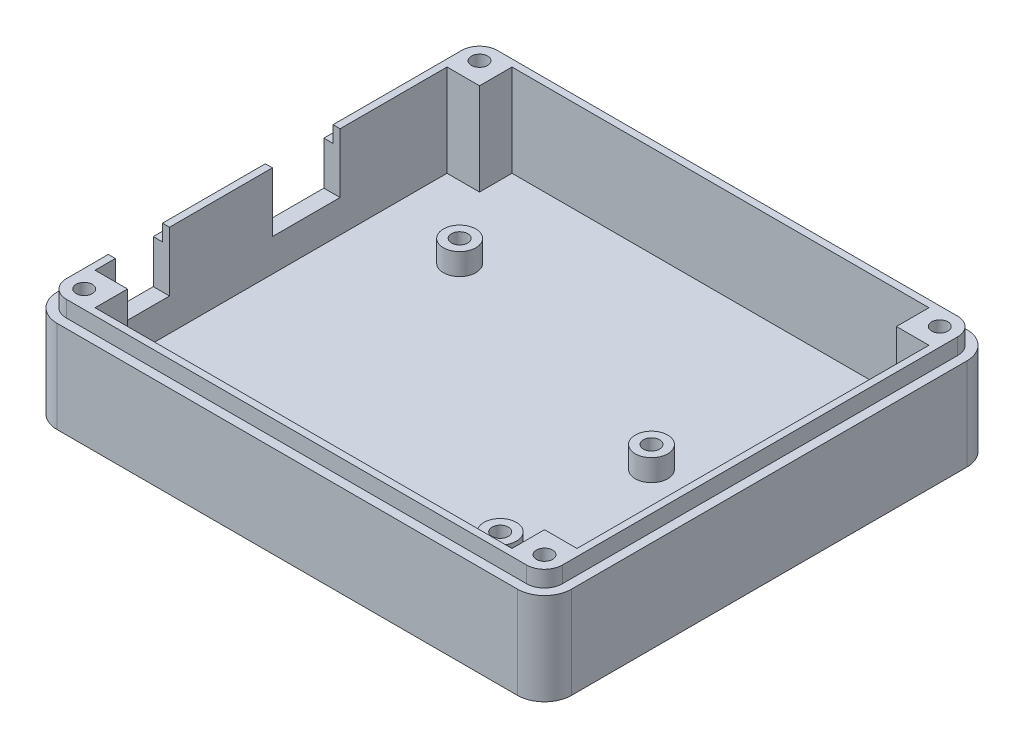
from build123d import *

# Parameters (mm, degrees)
SKETCH1_W           = 95
SKETCH1_H           = 83
BOSS_EXTRUDE1_DEPTH = 3
SKETCH2_W           = 95
SKETCH2_H           = 83
SKETCH2_W_2         = 89
SKETCH2_H_2         = 77
BOSS_EXTRUDE2_DEPTH = 17
SKETCH4_R           = 3
BOSS_EXTRUDE3_DEPTH = 4
SKETCH5_R           = 1.5
CUT_EXTRUDE2_DEPTH  = 7
SKETCH6_W           = 6
SKETCH6_H           = 6
BOSS_EXTRUDE4_DEPTH = 17
SKETCH7_R           = 1.5
CUT_EXTRUDE3_DEPTH  = 20
FILLET4_R           = 5
CUT_EXTRUDE4_DEPTH  = 3
CUT_EXTRUDE1_REACH  = 127.511
SKETCH3_W           = 10
SKETCH3_H           = 11
SKETCH3_W_2         = 12.5


with BuildPart() as part:
    # Sketch1 → Boss-Extrude1 (new body)
    with BuildSketch(Plane(origin=(0, 0, 0), x_dir=(1, 0, 0), z_dir=(0, 1, 0))):
        with Locations((47.5, 41.5)):
            Rectangle(SKETCH1_W, SKETCH1_H)
    extrude(amount=BOSS_EXTRUDE1_DEPTH)

    # Sketch2 → Boss-Extrude2 (add)
    with BuildSketch(Plane(origin=(0, 3, 0), x_dir=(1, 0, 0), z_dir=(0, 1, 0))):
        with Locations((47.5, 41.5)):
            Rectangle(SKETCH2_W, SKETCH2_H)
        with Locations((47.5, 41.5)):
            Rectangle(SKETCH2_W_2, SKETCH2_H_2, mode=Mode.SUBTRACT)
    extrude(amount=BOSS_EXTRUDE2_DEPTH)

    # Sketch4 → Boss-Extrude3 (add)
    with BuildSketch(Plane(origin=(0, 3, 0), x_dir=(1, 0, 0), z_dir=(0, 1, 0))):
        with Locations(Location((17.3, 12.5, 0), (0, 0, 90))):
            Circle(SKETCH4_R)
        with Locations(Location((18.57, 60.76, 0), (0, 0, 90))):
            Circle(SKETCH4_R)
        with Locations(Location((69.24, 45.52, 0), (0, 0, 90))):
            Circle(SKETCH4_R)
        with Locations(Location((69.24, 17.58, 0), (0, 0, 90))):
            Circle(SKETCH4_R)
    extrude(amount=BOSS_EXTRUDE3_DEPTH)

    # Sketch5 → Cut-Extrude2 (cut)
    with BuildSketch(Plane(origin=(0, 7, 0), x_dir=(1, 0, 0), z_dir=(0, 1, 0))):
        with Locations(Location((18.57, 60.76, 0), (0, 0, 270))):
            Circle(SKETCH5_R)
        with Locations(Location((69.24, 45.52, 0), (0, 0, 270))):
            Circle(SKETCH5_R)
        with Locations(Location((69.24, 17.58, 0), (0, 0, 270))):
            Circle(SKETCH5_R)
        with Locations(Location((17.3, 12.5, 0), (0, 0, 270))):
            Circle(SKETCH5_R)
    extrude(amount=-CUT_EXTRUDE2_DEPTH, mode=Mode.SUBTRACT)

    # Sketch6 → Boss-Extrude4 (add)
    with BuildSketch(Plane(origin=(0, 3, 0), x_dir=(1, 0, 0), z_dir=(0, 1, 0))):
        with Locations((6, 6)):
            Rectangle(SKETCH6_W, SKETCH6_H)
        with Locations((89, 6)):
            Rectangle(SKETCH6_W, SKETCH6_H)
        with Locations((89, 77)):
            Rectangle(SKETCH6_W, SKETCH6_H)
        with Locations((6, 77)):
            Rectangle(SKETCH6_W, SKETCH6_H)
    extrude(amount=BOSS_EXTRUDE4_DEPTH)

    # Sketch7 → Cut-Extrude3 (cut)
    with BuildSketch(Plane(origin=(0, 20, 0), x_dir=(1, 0, 0), z_dir=(0, 1, 0))):
        with Locations(Location((5, 5, 0), (0, 0, 270))):
            Circle(SKETCH7_R)
        with Locations(Location((90, 5, 0), (0, 0, 270))):
            Circle(SKETCH7_R)
        with Locations(Location((90, 78, 0), (0, 0, 270))):
            Circle(SKETCH7_R)
        with Locations(Location((5, 78, 0), (0, 0, 270))):
            Circle(SKETCH7_R)
    extrude(amount=-CUT_EXTRUDE3_DEPTH, mode=Mode.SUBTRACT)

    # Fillet4
    fillet4_edges = [part.edges().sort_by_distance(p)[0] for p in [
        (0, 10, -83),
        (95, 10, -83),
        (95, 10, 0),
        (0, 10, 0),
    ]]
    fillet(fillet4_edges, radius=FILLET4_R)

    # Sketch9 → Cut-Extrude4 (cut)
    with BuildSketch(Plane(origin=(0, 20, 0), x_dir=(1, 0, 0), z_dir=(0, 1, 0))):
        with BuildLine():
            Line((95, 5), (95, 78))
            ThreePointArc((95, 78), (93.535533906, 81.535533906), (90, 83))
            Line((90, 83), (5, 83))
            ThreePointArc((5, 83), (1.464466094, 81.535533906), (0, 78))
            Line((0, 78), (0, 5))
            ThreePointArc((0, 5), (1.464466094, 1.464466094), (5, 0))
            Line((5, 0), (90, 0))
            ThreePointArc((90, 0), (93.535533906, 1.464466094), (95, 5))
        make_face()
        with BuildLine():
            Line((93.3, 5), (93.3, 78))
            ThreePointArc((93.3, 78), (92.333452378, 80.333452378), (90, 81.3))
            Line((90, 81.3), (5, 81.3))
            ThreePointArc((5, 81.3), (2.666547622, 80.333452378), (1.7, 78))
            Line((1.7, 78), (1.7, 5))
            ThreePointArc((1.7, 5), (2.666547622, 2.666547622), (5, 1.7))
            Line((5, 1.7), (90, 1.7))
            ThreePointArc((90, 1.7), (92.333452378, 2.666547622), (93.3, 5))
        make_face(mode=Mode.SUBTRACT)
    extrude(amount=-CUT_EXTRUDE4_DEPTH, mode=Mode.SUBTRACT)

    # Cut-Extrude1: up to this face of the body (flat: up to its plane)
    cut_extrude1_end = Plane(part.part.faces().sort_by_distance((0, 8.5, -41.5))[0])
    # Sketch3 → Cut-Extrude1 (cut, up to the picked face)
    with BuildSketch(Plane(origin=(3, 0, 0), x_dir=(0, 0, -1), z_dir=(1, 0, 0)), mode=Mode.PRIVATE) as cut_extrude1_sk1:
        with Locations((17.75, 14.5)):
            Rectangle(SKETCH3_W, SKETCH3_H)
    cut_extrude1_tool1 = split(extrude(cut_extrude1_sk1.sketch, amount=-CUT_EXTRUDE1_REACH, mode=Mode.PRIVATE), bisect_by=cut_extrude1_end, keep=Keep.BOTH, mode=Mode.PRIVATE)
    # Sketch3 → Cut-Extrude1 (cut, up to the picked face)
    with BuildSketch(Plane(origin=(3, 0, 0), x_dir=(0, 0, -1), z_dir=(1, 0, 0)), mode=Mode.PRIVATE) as cut_extrude1_sk2:
        with Locations((48, 14.5)):
            Rectangle(SKETCH3_W_2, SKETCH3_H)
    cut_extrude1_tool2 = split(extrude(cut_extrude1_sk2.sketch, amount=-CUT_EXTRUDE1_REACH, mode=Mode.PRIVATE), bisect_by=cut_extrude1_end, keep=Keep.BOTH, mode=Mode.PRIVATE)
    add(cut_extrude1_tool1.solids().sort_by(Axis((3, 14.5, -17.75), (-1, 0, 0)))[0], mode=Mode.SUBTRACT)
    add(cut_extrude1_tool2.solids().sort_by(Axis((3, 14.5, -48), (-1, 0, 0)))[0], mode=Mode.SUBTRACT)


solid = part.part
